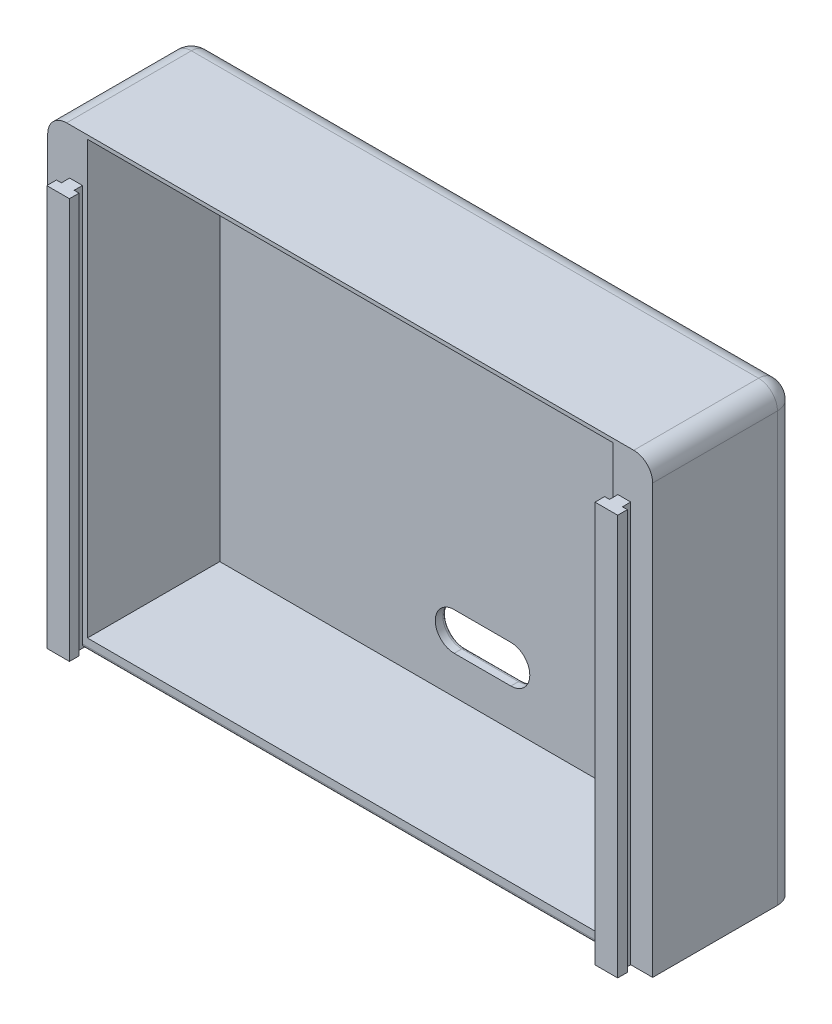
from build123d import *

# Parameters (mm, degrees)
SKETCH1_W       = 160
SKETCH1_H       = 118.25
MAIN_BODY_DEPTH = 38
TRACK_DEPTH     = 106
FILLET_2_R      = 5
SKETCH3_W       = 139
SKETCH3_H       = 112.25
STORAGE_DEPTH   = 35
WIRE_HOLE_DEPTH = 25
FILLET2_R       = 1
CHAMFER1_SIZE   = 2


with BuildPart() as part:
    # Sketch1 → Main Body (new body)
    with BuildSketch(Plane.XY):
        Rectangle(SKETCH1_W, SKETCH1_H)
    extrude(amount=MAIN_BODY_DEPTH)

    # Sketch2 → Track (add)
    with BuildSketch(Plane.XZ.offset(59.125)):
        Polygon((-72.5, 38), (-74.2, 38), (-74.2, 40.2), (-75.5, 40.2), (-75.5, 42.75), (-69.5, 42.75), (-69.5, 40.2), (-70.8, 40.2), (-70.8, 38), align=None)
    track = extrude(amount=-TRACK_DEPTH)

    # Mirror Track: Track across plane
    add(track.mirror(Plane(origin=(0, 0, 0), x_dir=(0, 0, 1), z_dir=(1, 0, 0))))

    # Fillet 2
    fillet_2_edges = [part.edges().sort_by_distance(p)[0] for p in [
        (-80, 0, 0),
        (0, 59.125, 0),
        (80, 0, 0),
        (-80, 59.125, 19),
        (80, 59.125, 19),
    ]]
    fillet(fillet_2_edges, radius=FILLET_2_R)

    # Sketch3 → Storage (cut)
    with BuildSketch(Plane.XY.offset(38)):
        Rectangle(SKETCH3_W, SKETCH3_H)
    extrude(amount=-STORAGE_DEPTH, mode=Mode.SUBTRACT)

    # Sketch4 → Wire Hole (cut)
    with BuildSketch(Plane.XY.offset(3)):
        with BuildLine():
            Line((-7.5, -36.125), (7.5, -36.125))
            ThreePointArc((7.5, -36.125), (12.5, -41.125), (7.5, -46.125))
            Line((7.5, -46.125), (-7.5, -46.125))
            ThreePointArc((-7.5, -46.125), (-12.5, -41.125), (-7.5, -36.125))
        make_face()
    extrude(amount=-WIRE_HOLE_DEPTH, mode=Mode.SUBTRACT)

    # Fillet2
    fillet2_edges = [part.edges().sort_by_distance(p)[0] for p in [
        (-12.5, -41.125, 0),
        (0, -36.125, 0),
        (12.5, -41.125, 0),
        (0, -46.125, 0),
        (0, -59.125, 38),
    ]]
    fillet(fillet2_edges, radius=FILLET2_R)

    # Chamfer1
    chamfer1_edges = [part.edges().sort_by_distance(p)[0] for p in [
        (0, 56.125, 38),
    ]]
    chamfer(chamfer1_edges, length=CHAMFER1_SIZE)


solid = part.part
